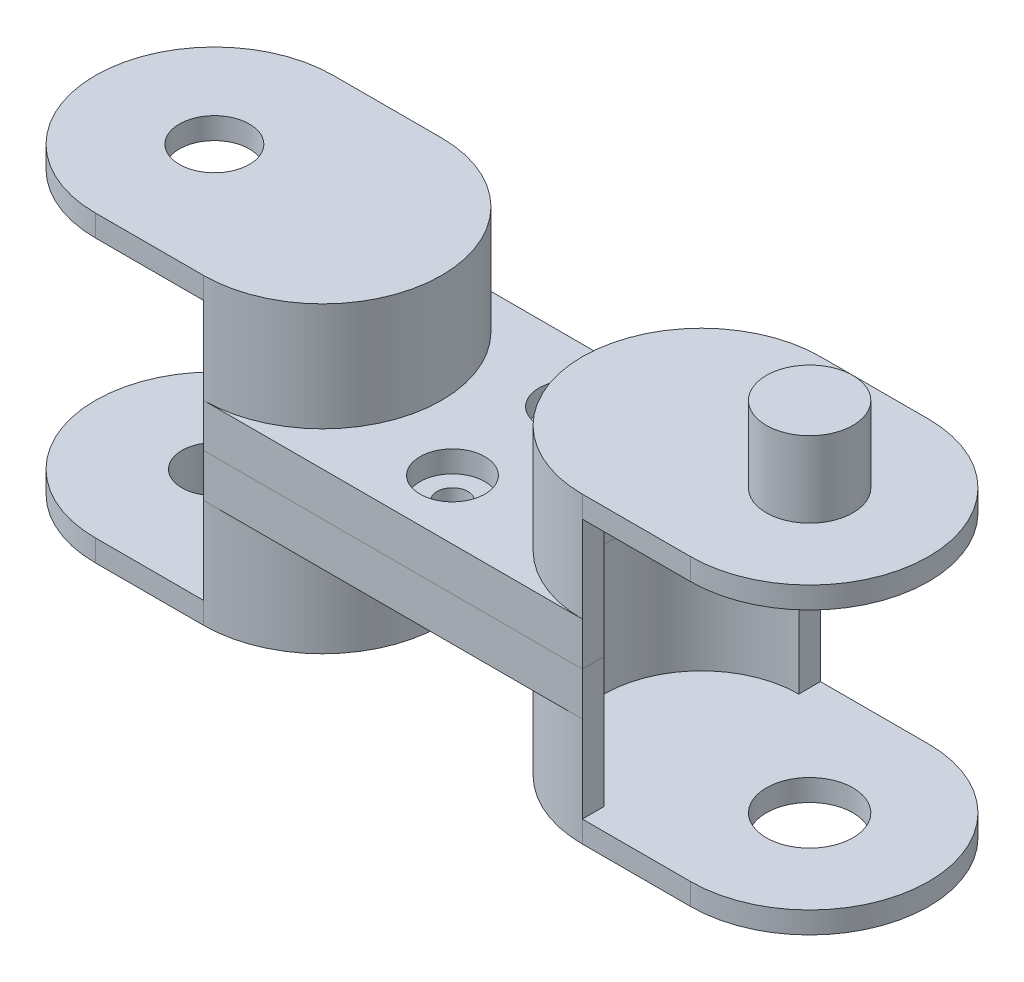
from build123d import *

# Parameters (mm, degrees)
SKETCH1_R           = 3.235333301
SKETCH1_R_2         = 3
BOSS_EXTRUDE1_DEPTH = 2
CUT_EXTRUDE1_DEPTH  = 2
BOSS_EXTRUDE2_DEPTH = 12
BOSS_EXTRUDE3_DEPTH = 4
SKETCH5_R           = 4
SKETCH5_R_2         = 3
BOSS_EXTRUDE4_DEPTH = 5
SKETCH6_R           = 4
BOSS_EXTRUDE5_DEPTH = 2
SKETCH7_R           = 3.754027052
SKETCH7_R_2         = 3
BOSS_EXTRUDE6_DEPTH = 2
SKETCH9_R           = 4
SKETCH9_R_2         = 3
BOSS_EXTRUDE7_DEPTH = 5
SKETCH10_R          = 4
BOSS_EXTRUDE8_DEPTH = 2
SKETCH12_R          = 3.936333862
SKETCH12_R_2        = 3
BOSS_EXTRUDE9_DEPTH = 2
SKETCH14_R          = 4
CUT_EXTRUDE3_DEPTH  = 5
SKETCH15_R          = 4
CUT_EXTRUDE4_DEPTH  = 5
SKETCH17_R          = 3
CUT_EXTRUDE6_DEPTH  = 2


with BuildPart() as part:
    # Sketch1 → Boss-Extrude1 (new body)
    with BuildSketch(Plane(origin=(0, 0, 0), x_dir=(1, 0, 0), z_dir=(0, 1, 0))):
        with BuildLine():
            Line((0, 11), (55, 11))
            ThreePointArc((55, 11), (66, 0), (55, -11))
            Line((55, -11), (0, -11))
            ThreePointArc((0, -11), (-11, 0), (0, 11))
        make_face()
        with Locations(Location((0, 0, 0), (0, 0, 270))):
            Circle(SKETCH1_R, mode=Mode.SUBTRACT)
        with Locations(Location((55, 0, 0), (0, 0, 270))):
            Circle(SKETCH1_R_2, mode=Mode.SUBTRACT)
    extrude(amount=BOSS_EXTRUDE1_DEPTH)

    # Sketch2 → Cut-Extrude1 (cut)
    with BuildSketch(Plane.XZ):
        with BuildLine():
            Line((10, 11), (45, 11))
            ThreePointArc((45, 11), (34, 0), (45, -11))
            Line((45, -11), (10, -11))
            ThreePointArc((10, -11), (21, 0), (10, 11))
        make_face()
    extrude(amount=-CUT_EXTRUDE1_DEPTH, mode=Mode.SUBTRACT)


with BuildPart() as cut_extrude1_piece_1:
    # of the separate pieces the step leaves, piece 1, a body of its own (cut_extrude1_pieces)
    add(part.part.solids().sort_by_distance((45, 0, -11))[0])



with BuildPart() as cut_extrude1_piece_2:
    # of the separate pieces the step leaves, piece 2, a body of its own (cut_extrude1_pieces)
    add(part.part.solids().sort_by_distance((0, 0, -11))[0])


with BuildPart() as cut_extrude1_piece_1_1:
    add(cut_extrude1_piece_1.part)

    add(cut_extrude1_piece_2.part)  # Boss-Extrude2 merges Cut-Extrude1 piece 2
    # Sketch3 → Boss-Extrude2 (add)
    with BuildSketch(Plane.XZ):
        with BuildLine():
            Line((45, 11), (45, 9))
            ThreePointArc((45, 9), (36, 0), (45, -9))
            Line((45, -9), (45, -11))
            ThreePointArc((45, -11), (34, 0), (45, 11))
        make_face()
        with BuildLine():
            Line((10, 11), (10, 9))
            ThreePointArc((10, 9), (19, 0), (10, -9))
            Line((10, -9), (10, -11))
            ThreePointArc((10, -11), (21, 0), (10, 11))
        make_face()
    extrude(amount=BOSS_EXTRUDE2_DEPTH)

    # Sketch4 → Boss-Extrude3 (add)
    with BuildSketch(Plane.XZ.offset(12)):
        with BuildLine():
            Line((10, -9), (10, -11))
            Line((10, -11), (45, -11))
            Line((45, -11), (45, -9))
            ThreePointArc((45, -9), (36, 0), (45, 9))
            Line((45, 9), (45, 11))
            Line((45, 11), (10, 11))
            Line((10, 11), (10, 9))
            ThreePointArc((10, 9), (19, 0), (10, -9))
        make_face()
    extrude(amount=-BOSS_EXTRUDE3_DEPTH)


with BuildPart() as body_2:
    # Mirror2: mirrored copy
    add(cut_extrude1_piece_1_1.part.mirror(Plane(origin=(0, -12, 0), x_dir=(0, 0, 1), z_dir=(0, -1, 0))))

    # Sketch7 → Boss-Extrude6 (add)
    with BuildSketch(Plane.XZ.offset(26)):
        Circle(SKETCH7_R)
        with Locations(Location((0, 0, 0), (0, 0, 270))):
            Circle(SKETCH7_R_2, mode=Mode.SUBTRACT)
    extrude(amount=-BOSS_EXTRUDE6_DEPTH)

    # Sketch9 → Boss-Extrude7 (add)
    with BuildSketch(Plane.XZ.offset(26)):
        with Locations(Location((0, 0, 0), (0, 0, 270))):
            Circle(SKETCH9_R)
        with Locations(Location((0, 0, 0), (0, 0, 270))):
            Circle(SKETCH9_R_2, mode=Mode.SUBTRACT)
    extrude(amount=BOSS_EXTRUDE7_DEPTH)

    # Sketch10 → Boss-Extrude8 (add)
    with BuildSketch(Plane.XZ.offset(31)):
        with Locations(Location((0, 0, 0), (0, 0, 270))):
            Circle(SKETCH10_R)
    extrude(amount=BOSS_EXTRUDE8_DEPTH)

    # Sketch15 → Cut-Extrude4 (cut)
    with BuildSketch(Plane.XZ.offset(26)):
        with Locations(Location((55, 0, 0), (0, 0, 270))):
            Circle(SKETCH15_R)
    extrude(amount=-CUT_EXTRUDE4_DEPTH, mode=Mode.SUBTRACT)


with BuildPart() as cut_extrude1_piece_1_2:
    add(cut_extrude1_piece_1_1.part)

    # Sketch5 → Boss-Extrude4 (add)
    with BuildSketch(Plane(origin=(0, 2, 0), x_dir=(1, 0, 0), z_dir=(0, 1, 0))):
        with Locations(Location((55, 0, 0), (0, 0, 270))):
            Circle(SKETCH5_R)
        with Locations(Location((55, 0, 0), (0, 0, 270))):
            Circle(SKETCH5_R_2, mode=Mode.SUBTRACT)
    extrude(amount=BOSS_EXTRUDE4_DEPTH)

    # Sketch6 → Boss-Extrude5 (add)
    with BuildSketch(Plane(origin=(0, 7, 0), x_dir=(1, 0, 0), z_dir=(0, 1, 0))):
        with Locations(Location((55, 0, 0), (0, 0, 270))):
            Circle(SKETCH6_R)
    extrude(amount=BOSS_EXTRUDE5_DEPTH)


with BuildPart() as body_3:
    # Sketch12 → Boss-Extrude9 (new body)
    with BuildSketch(Plane(origin=(0, 2, 0), x_dir=(1, 0, 0), z_dir=(0, 1, 0))):
        with Locations(Location((0, 0, 0), (0, 0, 270))):
            Circle(SKETCH12_R)
        with Locations(Location((0, 0, 0), (0, 0, 90))):
            Circle(SKETCH12_R_2, mode=Mode.SUBTRACT)
    extrude(amount=-BOSS_EXTRUDE9_DEPTH)

    # Sketch14 → Cut-Extrude3 (cut)
    with BuildSketch(Plane(origin=(0, 2, 0), x_dir=(1, 0, 0), z_dir=(0, 1, 0))):
        with Locations(Location((0, 0, 0), (0, 0, 90))):
            Circle(SKETCH14_R)
    extrude(amount=-CUT_EXTRUDE3_DEPTH, mode=Mode.SUBTRACT)


with BuildPart() as cut_extrude5_tool:
    # Cut-Extrude5 cone 1 section (through the dimple's axis) → Cut-Extrude5 (revolve)
    with BuildSketch(Plane(origin=(27.5, -8, -5.5), x_dir=(0, 0, 1), z_dir=(1, 0, 0))):
        Polygon((0, 0), (1.5, 0), (0, 42.954379924), align=None)
    revolve(axis=Axis((27.5, -8, -5.5), (0, -1, 0)))


with BuildPart() as cut_extrude1_piece_1_3:
    add(cut_extrude1_piece_1_2.part)

    # Cut-Extrude5: cut by cut_extrude5_tool
    add(cut_extrude5_tool.part, mode=Mode.SUBTRACT)


with BuildPart() as body_2_1:
    add(body_2.part)

    # Cut-Extrude5: cut by cut_extrude5_tool
    add(cut_extrude5_tool.part, mode=Mode.SUBTRACT)


with BuildPart() as cut_extrude5_cone_2_tool:
    # Cut-Extrude5 cone 2 section (through the dimple's axis) → Cut-Extrude5 cone 2 (revolve)
    with BuildSketch(Plane(origin=(27.5, -8, 5.5), x_dir=(0, 0, 1), z_dir=(1, 0, 0))):
        Polygon((0, 0), (1.5, 0), (0, 42.954379924), align=None)
    revolve(axis=Axis((27.5, -8, 5.5), (0, -1, 0)))


with BuildPart() as cut_extrude1_piece_1_4:
    add(cut_extrude1_piece_1_3.part)

    # Cut-Extrude5 cone 2: cut by cut_extrude5_cone_2_tool
    add(cut_extrude5_cone_2_tool.part, mode=Mode.SUBTRACT)

    # Sketch17 → Cut-Extrude6 (cut)
    with BuildSketch(Plane(origin=(0, -8, 0), x_dir=(1, 0, 0), z_dir=(0, 1, 0))):
        with Locations(Location((27.5, 5.5, 0), (0, 0, 270))):
            Circle(SKETCH17_R)
        with Locations(Location((27.5, -5.5, 0), (0, 0, 90))):
            Circle(SKETCH17_R)
    extrude(amount=-CUT_EXTRUDE6_DEPTH, mode=Mode.SUBTRACT)


with BuildPart() as body_2_2:
    add(body_2_1.part)

    # Cut-Extrude5 cone 2: cut by cut_extrude5_cone_2_tool
    add(cut_extrude5_cone_2_tool.part, mode=Mode.SUBTRACT)


solid = Compound([cut_extrude1_piece_1_4.part, body_2_2.part])
